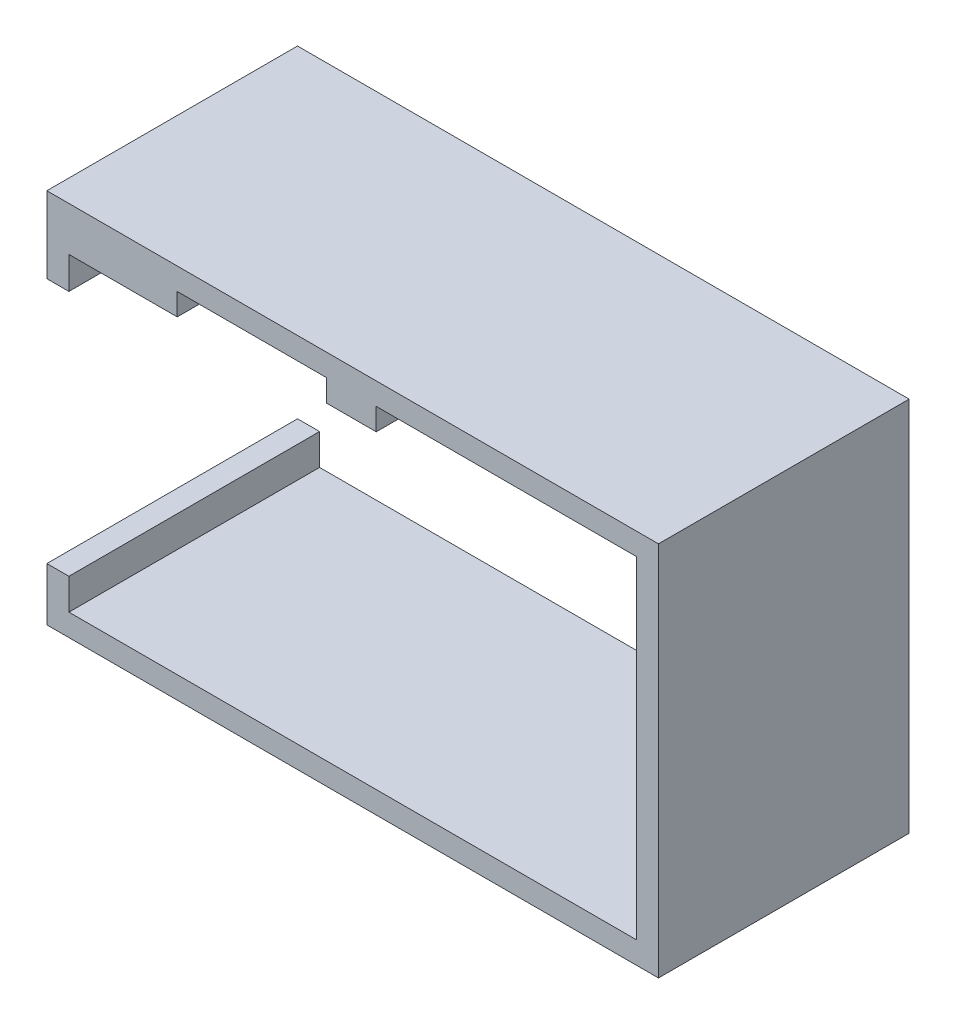
from build123d import *

# Parameters (mm, degrees)
BOSS_EXTRU_1_DEPTH = 2500


with BuildPart() as part:
    # Esquisse1 → Boss.-Extru.1 (new body)
    with BuildSketch(Plane.XY):
        Polygon((0, 0), (5660, 0), (5660, 3310), (3065, 3310), (3065, 3090), (2570, 3090), (2570, 3310), (1080, 3310), (1080, 3090), (0, 3090), (0, 2770), (-220, 2770), (-220, 3530), (5880, 3530), (5880, -220), (-220, -220), (-220, 310), (0, 310), align=None)
    extrude(amount=BOSS_EXTRU_1_DEPTH)


solid = part.part
